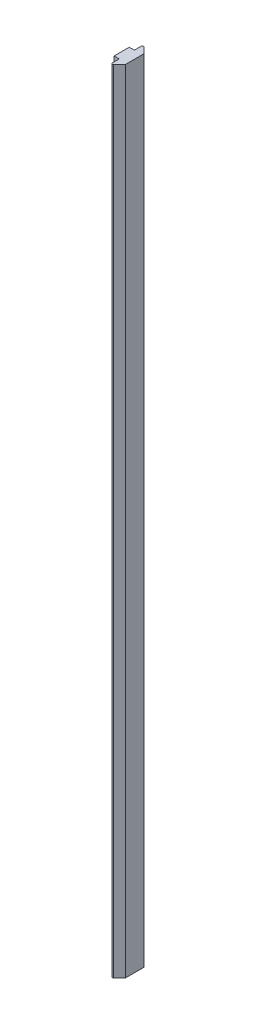
from build123d import *

# Parameters (mm, degrees)
BOSS_EXTRUDE1_DEPTH = 300


with BuildPart() as part:
    # Sketch1 → Boss-Extrude1 (new body)
    with BuildSketch(Plane(origin=(0, 0, 0), x_dir=(1, 0, 0), z_dir=(0, 1, 0))):
        with BuildLine():
            Line((-3.239339866, -2.878050905), (-3.239339866, -5.427441221))
            ThreePointArc((-3.239339866, -5.427441221), (-2.961547411, -5.843187011), (-2.471141815, -5.745639273))
            Line((-2.471141815, -5.745639273), (-0.25, -3.524497458))
            Line((-0.25, -3.524497458), (-0.25, 3.524497458))
            Line((-0.25, 3.524497458), (-2.471141814, 5.745639272))
            ThreePointArc((-2.471141814, 5.745639272), (-2.961547408, 5.84318701), (-3.239339864, 5.427441222))
            Line((-3.239339864, 5.427441222), (-3.239339864, 2.878050849))
            Line((-3.239339864, 2.878050849), (-4.939339838, 2.878050849))
            Line((-4.939339838, 2.878050849), (-5.189339838, 2.878050849))
            Line((-5.189339838, 2.878050849), (-5.189339838, -2.878050905))
            Line((-5.189339838, -2.878050905), (-3.239339866, -2.878050905))
        make_face()
    extrude(amount=BOSS_EXTRUDE1_DEPTH)


solid = part.part
